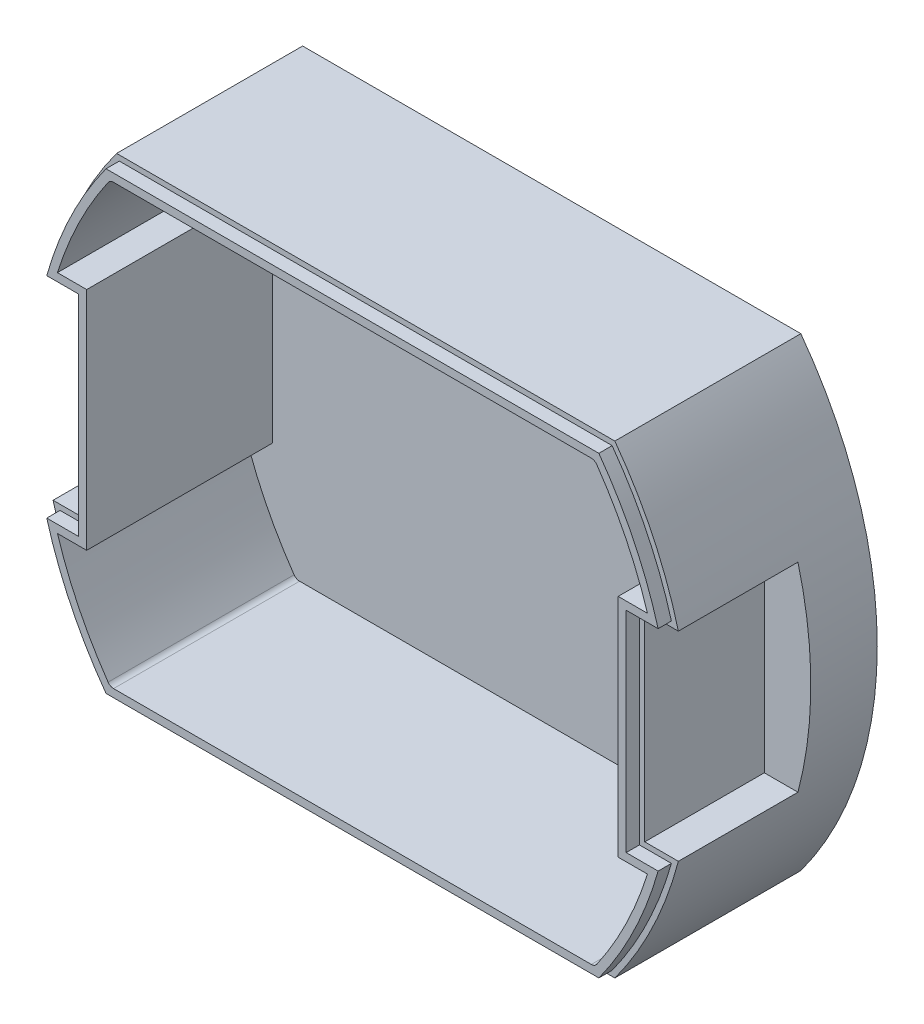
from build123d import *
from build123d.topology import SkipClean

# Parameters (mm, degrees)
BOSS_EXTRUDE4_DEPTH  = 10
BOSS_EXTRUDE10_DEPTH = 18
BOSS_EXTRUDE11_DEPTH = 2
CUT_EXTRUDE8_DEPTH   = 28


with BuildPart() as part:
    # Sketch1 → Boss-Extrude4 (new body)
    with BuildSketch(Plane.XY):
        with BuildLine():
            Line((0, 0), (75, 0))
            ThreePointArc((75, 0), (86.502118606, 35), (75, 70))
            Line((75, 70), (0, 70))
            ThreePointArc((0, 70), (-11.502118606, 35), (0, 0))
        make_face()
    extrude(amount=BOSS_EXTRUDE4_DEPTH)

    # Sketch4 → Boss-Extrude10 (add)
    with SkipClean():  # the faces are left unmerged after this step: merging them gives an invalid solid
        with BuildSketch(Plane.XY.offset(10)):
            with BuildLine():
                Line((79.502118606, 20), (84.563561053, 20))
                ThreePointArc((84.563561053, 20), (80.729546072, 9.546799317), (75, 0))
                Line((75, 0), (0, 0))
                ThreePointArc((0, 0), (-5.729546072, 9.546799317), (-9.563561053, 20))
                Line((-9.563561053, 20), (-4.502118606, 20))
                Line((-4.502118606, 20), (-4.502118606, 50))
                Line((-4.502118606, 50), (-9.563561053, 50))
                ThreePointArc((-9.563561053, 50), (-5.729546072, 60.453200683), (0, 70))
                Line((0, 70), (75, 70))
                ThreePointArc((75, 70), (80.729546072, 60.453200683), (84.563561053, 50))
                Line((84.563561053, 50), (79.502118606, 50))
                Line((79.502118606, 50), (79.502118606, 20))
            make_face()
        extrude(amount=BOSS_EXTRUDE10_DEPTH)

    # Sketch9 → Boss-Extrude11 (add)
    with SkipClean():  # the faces are left unmerged after this step: merging them gives an invalid solid
        with BuildSketch(Plane.XY.offset(28)):
            with BuildLine():
                Line((-8.516485165, 50.8), (-3.702118606, 50.8))
                Line((-3.702118606, 50.8), (-3.702118606, 19.2))
                Line((-3.702118606, 19.2), (-8.516485165, 19.2))
                ThreePointArc((-8.516485165, 19.2), (-4.869685973, 9.605067408), (0.405981163, 0.8))
                Line((0.405981163, 0.8), (74.594018837, 0.8))
                ThreePointArc((74.594018837, 0.8), (79.869685973, 9.605067408), (83.516485165, 19.2))
                Line((83.516485165, 19.2), (78.702118606, 19.2))
                Line((78.702118606, 19.2), (78.702118606, 50.8))
                Line((78.702118606, 50.8), (83.516485165, 50.8))
                ThreePointArc((83.516485165, 50.8), (79.869685973, 60.394932592), (74.594018837, 69.2))
                Line((74.594018837, 69.2), (0.405981163, 69.2))
                ThreePointArc((0.405981163, 69.2), (-4.869685973, 60.394932592), (-8.516485165, 50.8))
            make_face()
        extrude(amount=BOSS_EXTRUDE11_DEPTH)

    # Sketch10 → Cut-Extrude8 (cut)
    with SkipClean():  # the faces are left unmerged after this step: merging them gives an invalid solid
        with BuildSketch(Plane.XY.offset(30)):
            with BuildLine():
                Line((-6.908101654, 52), (-2.502118606, 52))
                Line((-2.502118606, 52), (-2.502118606, 18))
                Line((-2.502118606, 18), (-6.908101654, 18))
                ThreePointArc((-6.908101654, 18), (-3.68947636, 9.922539293), (0.720250379, 2.428593046))
                ThreePointArc((0.720250379, 2.428593046), (1.077995513, 2.113600837), (1.540917238, 2))
                Line((1.540917238, 2), (73.459082762, 2))
                ThreePointArc((73.459082762, 2), (73.922004487, 2.113600837), (74.279749621, 2.428593046))
                ThreePointArc((74.279749621, 2.428593046), (78.68947636, 9.922539293), (81.908101654, 18))
                Line((81.908101654, 18), (77.502118606, 18))
                Line((77.502118606, 18), (77.502118606, 52))
                Line((77.502118606, 52), (81.908101654, 52))
                ThreePointArc((81.908101654, 52), (78.68947636, 60.077460707), (74.279749621, 67.571406954))
                ThreePointArc((74.279749621, 67.571406954), (73.922004487, 67.886399163), (73.459082762, 68))
                Line((73.459082762, 68), (1.540917238, 68))
                ThreePointArc((1.540917238, 68), (1.077995513, 67.886399163), (0.720250379, 67.571406954))
                ThreePointArc((0.720250379, 67.571406954), (-3.68947636, 60.077460707), (-6.908101654, 52))
            make_face()
        extrude(amount=-CUT_EXTRUDE8_DEPTH, mode=Mode.SUBTRACT)


solid = part.part
